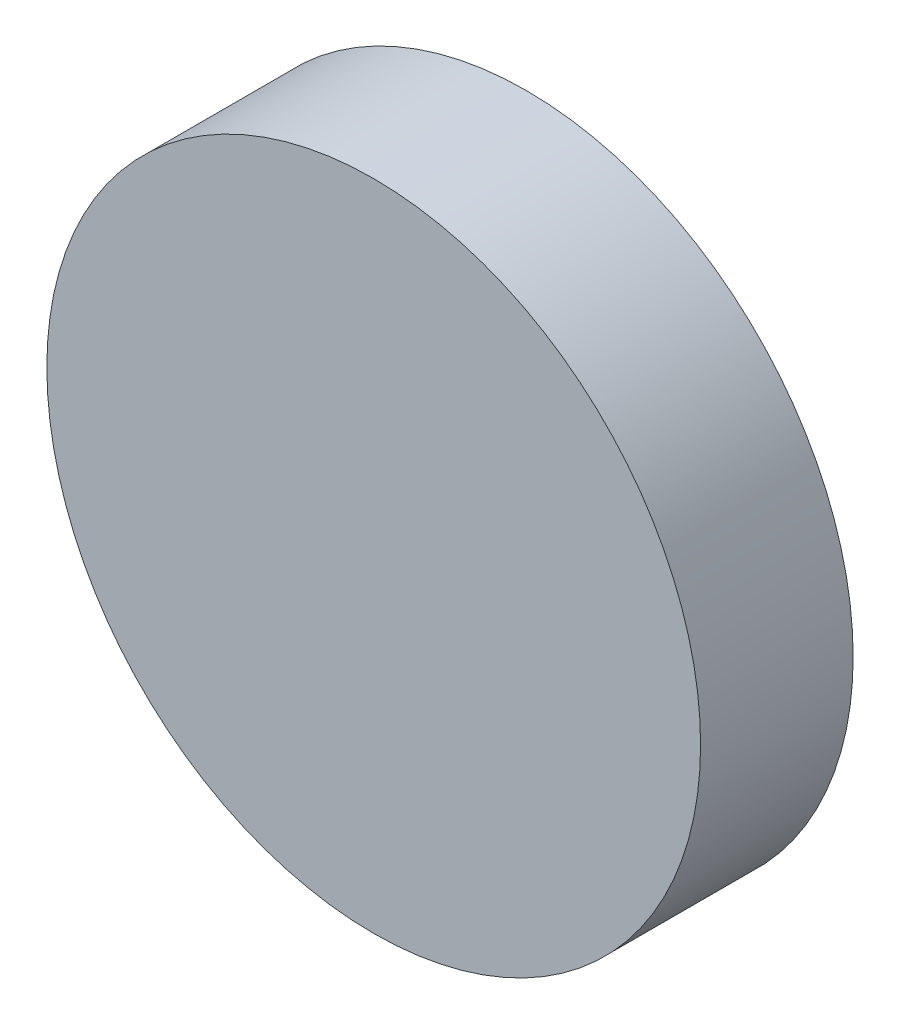
from build123d import *

# Parameters (mm, degrees)
SKETCH1_R           = 10.8839
BOSS_EXTRUDE1_DEPTH = 5.08
SKETCH2_R           = 3.937
BOSS_EXTRUDE2_DEPTH = 3.302


with BuildPart() as part:
    # Sketch1 → Boss-Extrude1 (new body)
    with BuildSketch(Plane.XY):
        Circle(SKETCH1_R)
    extrude(amount=BOSS_EXTRUDE1_DEPTH)

    # Sketch2 → Boss-Extrude2 (add)
    with BuildSketch(Plane(origin=(0, 0, 0), x_dir=(-1, 0, 0), z_dir=(0, 0, -1))):
        with Locations(Location((0, 0, 0), (0, 0, 180))):
            Circle(SKETCH2_R)
    extrude(amount=BOSS_EXTRUDE2_DEPTH)


solid = part.part
